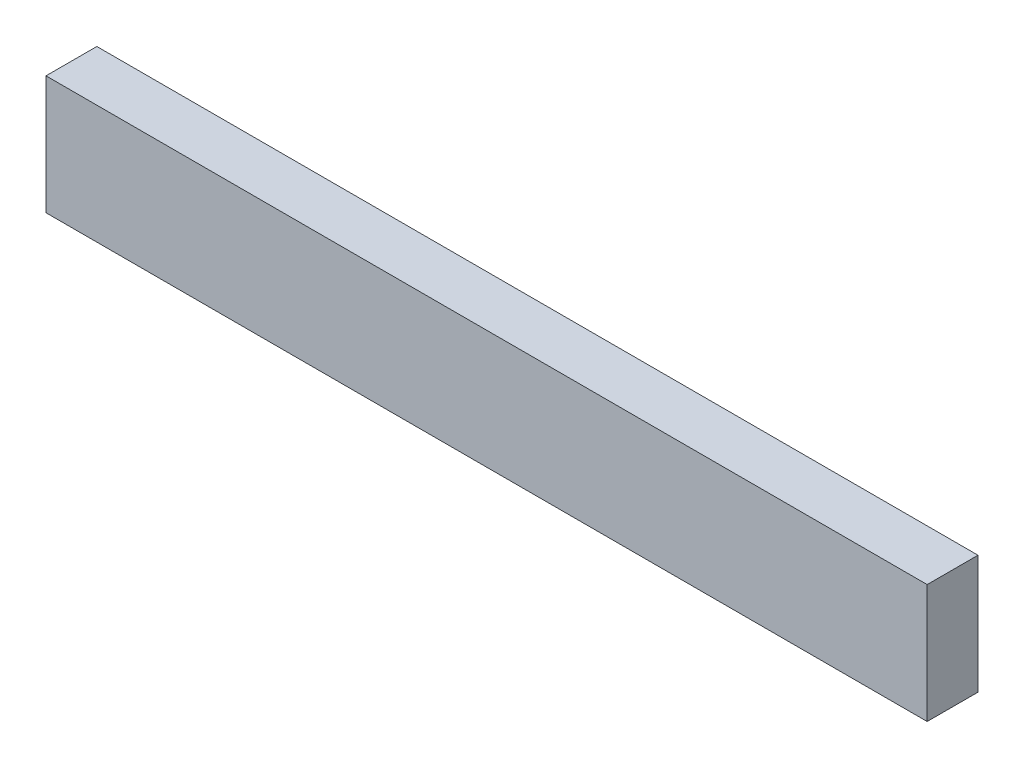
from build123d import *

# Parameters (mm, degrees)
SKETCH1_W           = 38.1
SKETCH1_H           = 88.9
BOSS_EXTRUDE1_DEPTH = 660.4


with BuildPart() as part:
    # Sketch1 → Boss-Extrude1 (new body)
    with BuildSketch(Plane(origin=(0, 0, 0), x_dir=(0, 0, -1), z_dir=(1, 0, 0))):
        Rectangle(SKETCH1_W, SKETCH1_H)
    extrude(amount=BOSS_EXTRUDE1_DEPTH)


solid = part.part
